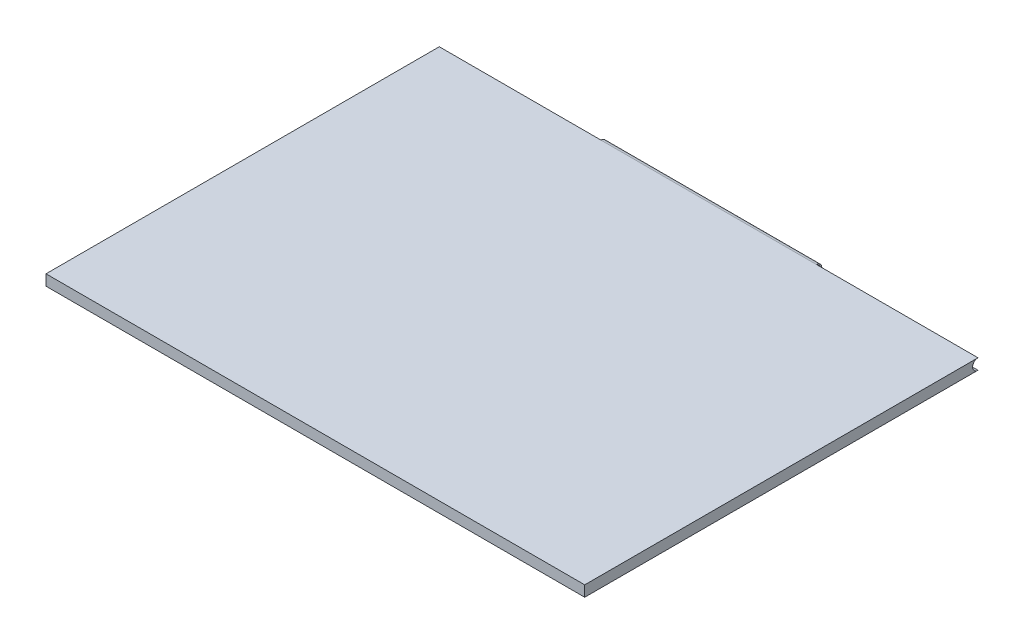
from build123d import *

# Parameters (mm, degrees)
SKETCH_1_W          = 200
SKETCH_1_H          = 146
EXTRUDE_1_DEPTH     = 4
SKETCH_3_R          = 2
CUT_EXTRUDE_1_DEPTH = 202
SKETCH_3_2_R        = 2
SKETCH_3_2_R_2      = 1.5
EXTRUDE_1_2_DEPTH   = 200
SKETCH_4_R          = 2
CUT_EXTRUDE_2_DEPTH = 60
CUT_EXTRUDE_START   = -60
SKETCH_5_R          = 2
CUT_EXTRUDE_3_DEPTH = 60


with BuildPart() as part:
    # 草图1 → Extrude 1 (new body)
    with BuildSketch(Plane(origin=(0, 0, 0), x_dir=(1, 0, 0), z_dir=(0, 1, 0))):
        with Locations((4.739336493, 7.123222749)):
            Rectangle(SKETCH_1_W, SKETCH_1_H)
    extrude(amount=EXTRUDE_1_DEPTH)

    # 草图3 → 切除-拉伸1 (cut)
    with BuildSketch(Plane(origin=(104.739336493, 0, 0), x_dir=(0, 0, -1), z_dir=(1, 0, 0))):
        with Locations((80.123222749, 2)):
            Circle(SKETCH_3_R)
    extrude(amount=-CUT_EXTRUDE_1_DEPTH, mode=Mode.SUBTRACT)

    # 草图3<2> → Extrude 1 2 (add)
    with BuildSketch(Plane(origin=(104.739336493, 0, 0), x_dir=(0, 0, -1), z_dir=(1, 0, 0))):
        with Locations((80.123222749, 2)):
            Circle(SKETCH_3_2_R)
        with Locations((80.123222749, 2)):
            Circle(SKETCH_3_2_R_2, mode=Mode.SUBTRACT)
    extrude(amount=-EXTRUDE_1_2_DEPTH)

    # 草图4 → 切除-拉伸2 (cut)
    with BuildSketch(Plane(origin=(104.739336493, 0, 0), x_dir=(0, 0, -1), z_dir=(1, 0, 0))):
        with Locations((80.123222749, 2)):
            Circle(SKETCH_4_R)
    extrude(amount=-CUT_EXTRUDE_2_DEPTH, mode=Mode.SUBTRACT)

    # 草图5 → 切除-拉伸3 (cut)
    with BuildSketch(Plane.ZY.offset(95.260663507).offset(CUT_EXTRUDE_START)):
        with Locations((-80.123222749, 2)):
            Circle(SKETCH_5_R)
    extrude(amount=CUT_EXTRUDE_3_DEPTH, mode=Mode.SUBTRACT)


solid = part.part
